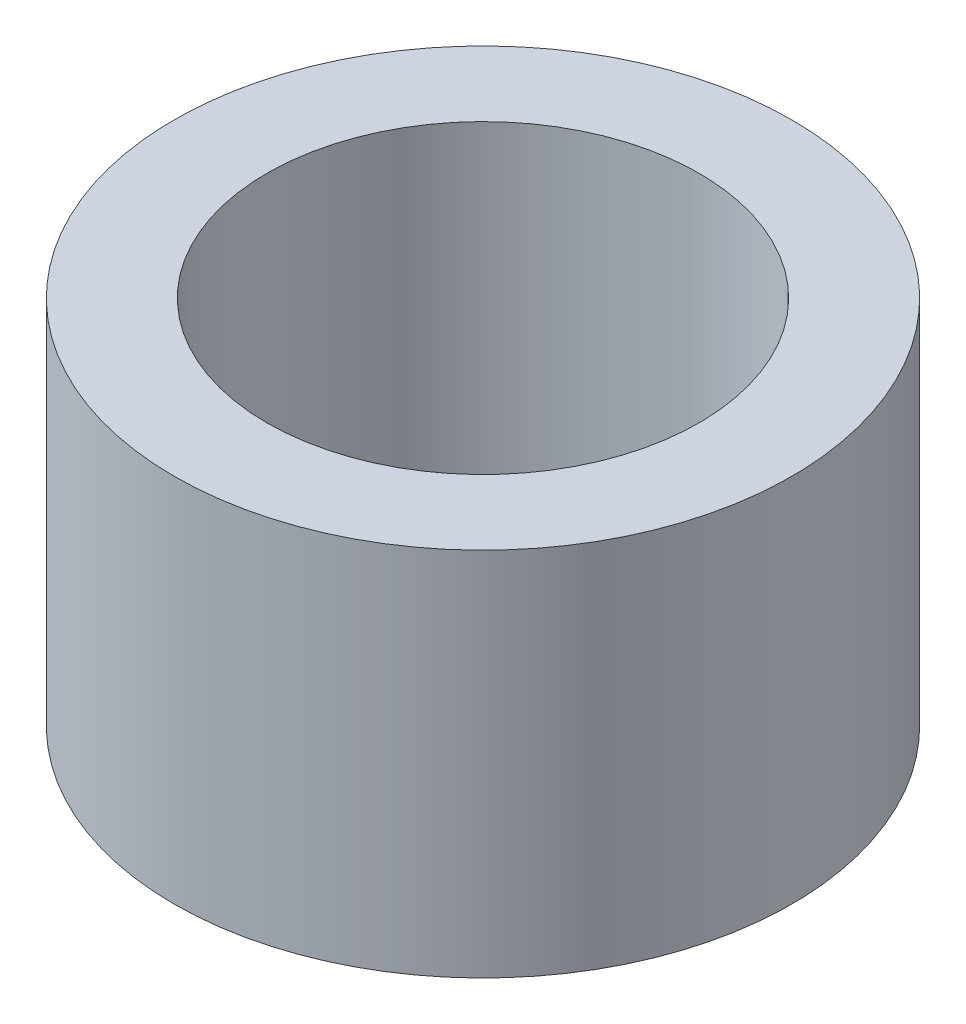
from build123d import *

# Parameters (mm, degrees)
SKETCH1_R           = 2.5
SKETCH1_R_2         = 1.75
BOSS_EXTRUDE1_DEPTH = 3


with BuildPart() as part:
    # Sketch1 → Boss-Extrude1 (new body)
    with BuildSketch(Plane(origin=(0, 0, 0), x_dir=(1, 0, 0), z_dir=(0, 1, 0))):
        with Locations(Location((0, 0, 0), (0, 0, 270))):
            Circle(SKETCH1_R)
        with Locations(Location((0, 0, 0), (0, 0, 270))):
            Circle(SKETCH1_R_2, mode=Mode.SUBTRACT)
    extrude(amount=BOSS_EXTRUDE1_DEPTH)


solid = part.part
